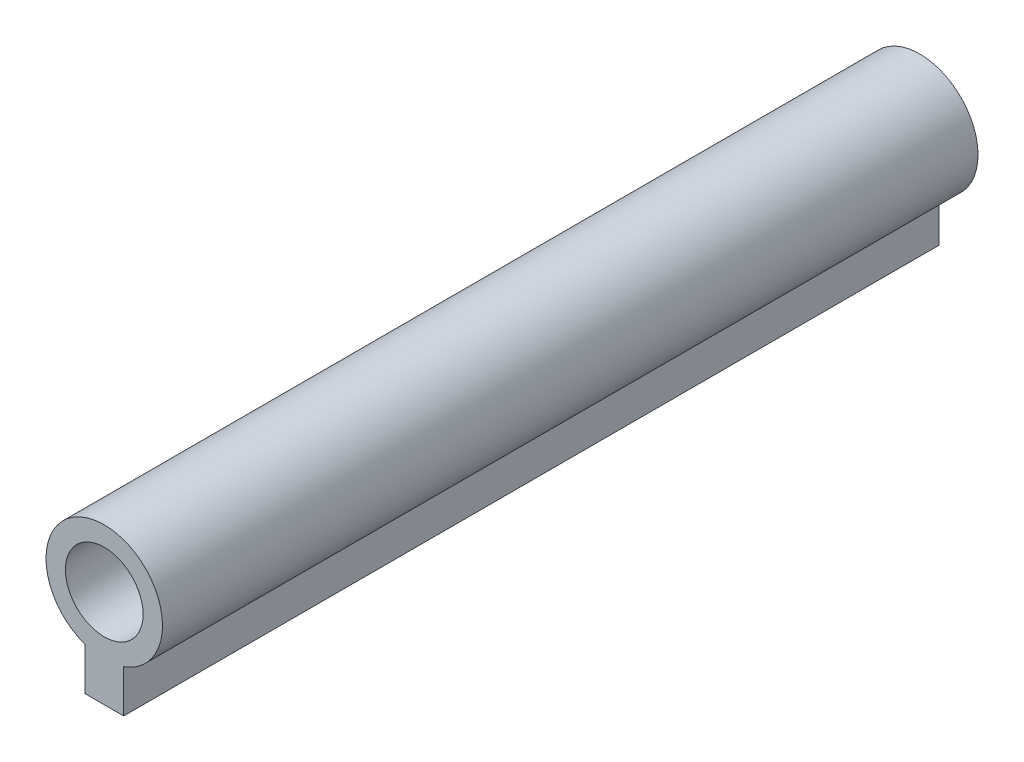
from build123d import *

# Parameters (mm, degrees)
SKETCH1_R               = 5
BOSS_EXTRUDE1_DEPTH     = 21
CUT_EXTRUDE1_DEPTH      = 23.158519806
CUT_EXTRUDE1_DEPTH_BACK = 23.158519806
SKETCH2_OUTSIDE_W       = 17.064
SKETCH2_OUTSIDE_H       = 17.064
SKETCH6_R               = 1
CUT_EXTRUDE4_DEPTH      = 6


with BuildPart() as part:
    # Sketch1 → Boss-Extrude1 (new body)
    with BuildSketch(Plane.XY):
        with Locations(Location((0, 0, 0), (0, 0, 180))):
            Circle(SKETCH1_R)
    extrude(amount=BOSS_EXTRUDE1_DEPTH)

    # Sketch2 outside → Cut-Extrude1 (cut, two sides: drawn at the far end of the back side and taken through both)
    with BuildSketch(Plane(origin=(0, 0, 0), x_dir=(-1, 0, 0), z_dir=(0, 0, -1)).offset(-CUT_EXTRUDE1_DEPTH_BACK)):
        Rectangle(SKETCH2_OUTSIDE_W, SKETCH2_OUTSIDE_H)
        with BuildLine():
            Line((-0.5, -1.414213562), (-0.5, -2.514213562))
            Line((-0.5, -2.514213562), (0.5, -2.514213562))
            Line((0.5, -2.514213562), (0.5, -1.414213562))
            ThreePointArc((0.5, -1.414213562), (0, 1.5), (-0.5, -1.414213562))
        make_face(mode=Mode.SUBTRACT)
    extrude(amount=CUT_EXTRUDE1_DEPTH + CUT_EXTRUDE1_DEPTH_BACK, mode=Mode.SUBTRACT)

    # Sketch6 → Cut-Extrude4 (cut)
    with BuildSketch(Plane.XY.offset(21)):
        Circle(SKETCH6_R)
    extrude(amount=-CUT_EXTRUDE4_DEPTH, mode=Mode.SUBTRACT)


solid = part.part
